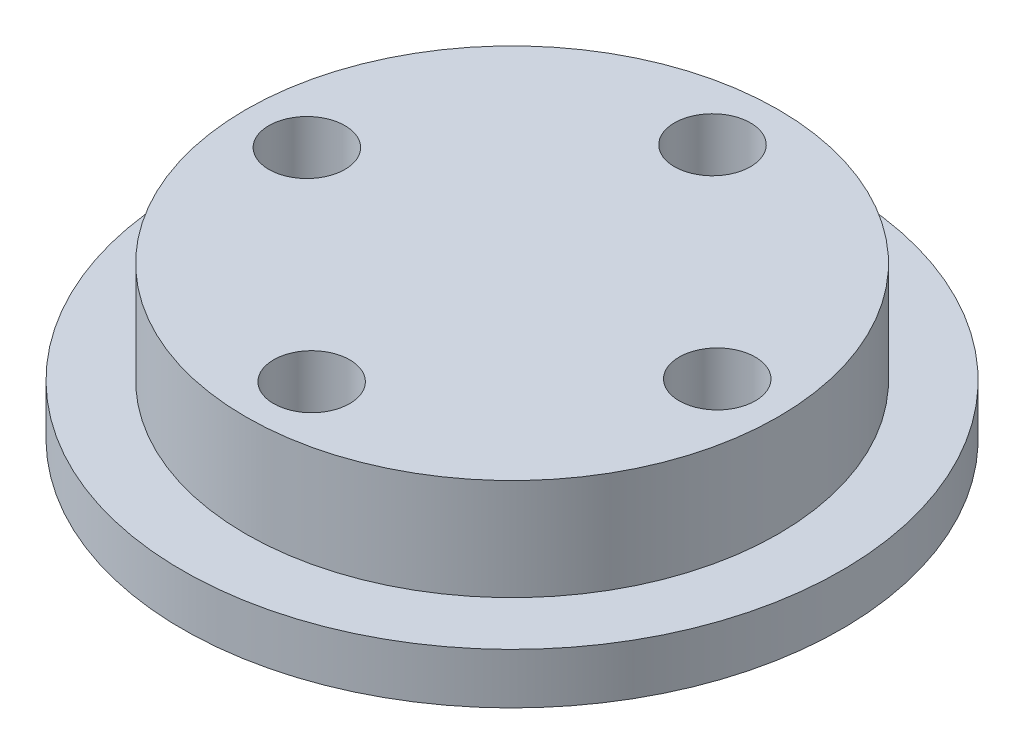
from build123d import *

# Parameters (mm, degrees)
ESQUISSE1_R             = 10.5
BOSS_EXTRU_1_DEPTH      = 4
ESQUISSE2_R             = 13
BOSS_EXTRU_2_DEPTH      = 2
ESQUISSE3_R             = 1.5
ENL_V_MAT_EXTRU_1_DEPTH = 20.339079606


with BuildPart() as part:
    # Esquisse1 → Boss.-Extru.1 (new body)
    with BuildSketch(Plane(origin=(0, 0, 0), x_dir=(1, 0, 0), z_dir=(0, 1, 0))):
        with Locations(Location((0, 0, 0), (0, 0, 270))):
            Circle(ESQUISSE1_R)
    extrude(amount=BOSS_EXTRU_1_DEPTH)

    # Esquisse2 → Boss.-Extru.2 (add)
    with BuildSketch(Plane.XZ):
        with Locations(Location((0, 0, 0), (0, 0, 270))):
            Circle(ESQUISSE2_R)
    extrude(amount=BOSS_EXTRU_2_DEPTH)

    # Esquisse3 → Enlèv. mat.-Extru.1 (cut, through all)
    with BuildSketch(Plane(origin=(0, 4, 0), x_dir=(1, 0, 0), z_dir=(0, 1, 0))):
        with Locations(Location((-7.999447207, -0.094044544, 0), (0, 0, 270))):
            Circle(ESQUISSE3_R)
        with Locations(Location((-0.094044544, 7.999447207, 0), (0, 0, 270))):
            Circle(ESQUISSE3_R)
        with Locations(Location((0.094044544, -7.999447207, 0), (0, 0, 270))):
            Circle(ESQUISSE3_R)
        with Locations(Location((7.999447207, 0.094044544, 0), (0, 0, 270))):
            Circle(ESQUISSE3_R)
    extrude(amount=-ENL_V_MAT_EXTRU_1_DEPTH, mode=Mode.SUBTRACT)


solid = part.part
